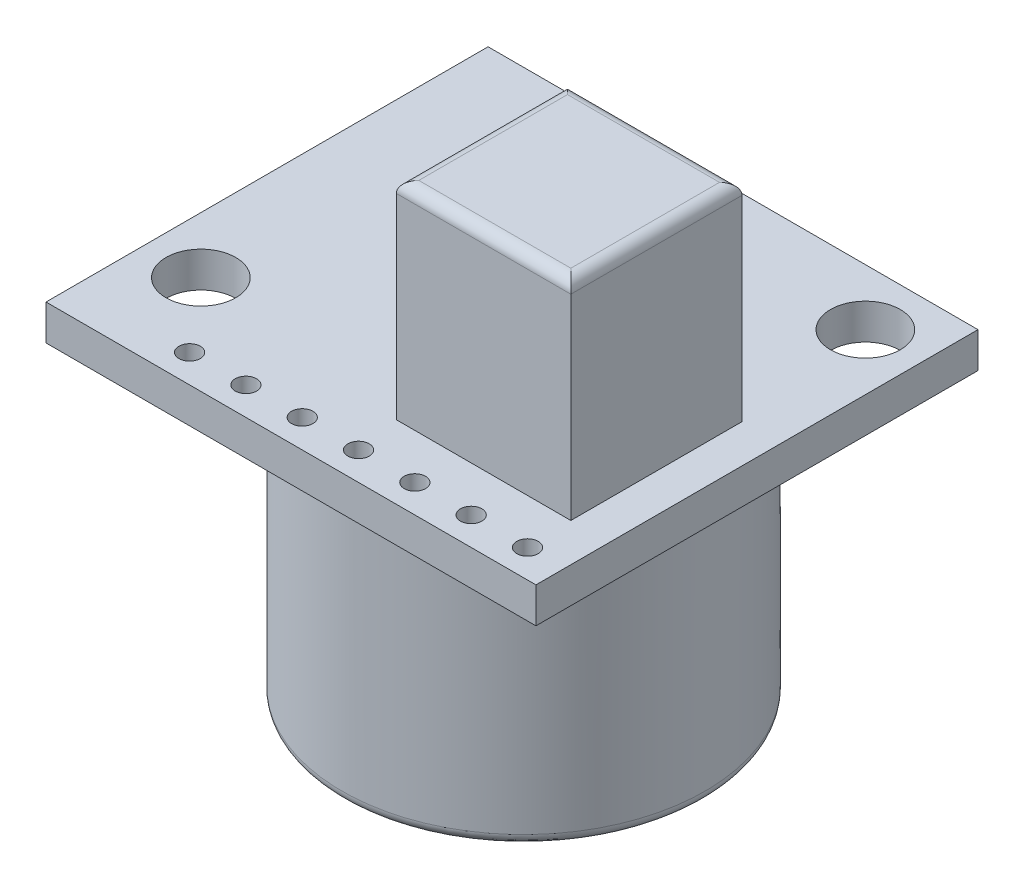
from build123d import *

# Parameters (mm, degrees)
SKETCH1_W           = 22.098
SKETCH1_H           = 19.939
SKETCH1_R           = 1.5748
SKETCH1_R_2         = 0.4826
BOSS_EXTRUDE1_DEPTH = 1.6002
SKETCH2_W           = 7.874
SKETCH2_H           = 7.7216
BOSS_EXTRUDE2_DEPTH = 9.3472
SKETCH7_R           = 8.1915
BOSS_EXTRUDE6_DEPTH = 13.6398
SKETCH8_W           = 4.572
SKETCH8_H           = 6.604
BOSS_EXTRUDE7_DEPTH = 2.032
FILLET2_R           = 0.508
FILLET3_R           = 0.508


with BuildPart() as part:
    # Sketch1 → Boss-Extrude1 (new body)
    with BuildSketch(Plane(origin=(0, 0, 0), x_dir=(1, 0, 0), z_dir=(0, 1, 0))):
        Rectangle(SKETCH1_W, SKETCH1_H)
        with Locations(Location((8.509, 7.4295, 0), (0, 0, 270))):
            Circle(SKETCH1_R, mode=Mode.SUBTRACT)
        with Locations(Location((-8.509, -5.5245, 0), (0, 0, 270))):
            Circle(SKETCH1_R, mode=Mode.SUBTRACT)
        with Locations(Location((9.398, -8.6995, 0), (0, 0, 270))):
            Circle(SKETCH1_R_2, mode=Mode.SUBTRACT)
        with Locations(Location((6.858, -8.6995, 0), (0, 0, 270))):
            Circle(SKETCH1_R_2, mode=Mode.SUBTRACT)
        with Locations(Location((4.318, -8.6995, 0), (0, 0, 270))):
            Circle(SKETCH1_R_2, mode=Mode.SUBTRACT)
        with Locations(Location((1.778, -8.6995, 0), (0, 0, 270))):
            Circle(SKETCH1_R_2, mode=Mode.SUBTRACT)
        with Locations(Location((-0.762, -8.6995, 0), (0, 0, 270))):
            Circle(SKETCH1_R_2, mode=Mode.SUBTRACT)
        with Locations(Location((-3.302, -8.6995, 0), (0, 0, 270))):
            Circle(SKETCH1_R_2, mode=Mode.SUBTRACT)
        with Locations(Location((-5.842, -8.6995, 0), (0, 0, 270))):
            Circle(SKETCH1_R_2, mode=Mode.SUBTRACT)
    extrude(amount=BOSS_EXTRUDE1_DEPTH)

    # Sketch2 → Boss-Extrude2 (add)
    with BuildSketch(Plane(origin=(0, 1.6002, 0), x_dir=(1, 0, 0), z_dir=(0, 1, 0))):
        with Locations((5.3848, -2.8067)):
            Rectangle(SKETCH2_W, SKETCH2_H)
    extrude(amount=BOSS_EXTRUDE2_DEPTH)

    # Sketch7 → Boss-Extrude6 (add)
    with BuildSketch(Plane.XZ):
        with Locations(Location((0, -0.5207, 0), (0, 0, 270))):
            Circle(SKETCH7_R)
    extrude(amount=BOSS_EXTRUDE6_DEPTH)

    # Sketch8 → Boss-Extrude7 (add)
    with BuildSketch(Plane.XZ):
        with Locations((-8.255, -4.6355)):
            Rectangle(SKETCH8_W, SKETCH8_H)
    extrude(amount=BOSS_EXTRUDE7_DEPTH)

    # Fillet2
    fillet2_edges = [part.edges().sort_by_distance(p)[0] for p in [
        (0, -13.6398, 7.6708),
    ]]
    fillet(fillet2_edges, radius=FILLET2_R)

    # Fillet3
    fillet3_edges = [part.edges().sort_by_distance(p)[0] for p in [
        (1.4478, 10.9474, 2.8067),
        (5.3848, 10.9474, 6.6675),
        (9.3218, 10.9474, 2.8067),
        (5.3848, 10.9474, -1.0541),
    ]]
    fillet(fillet3_edges, radius=FILLET3_R)


solid = part.part
